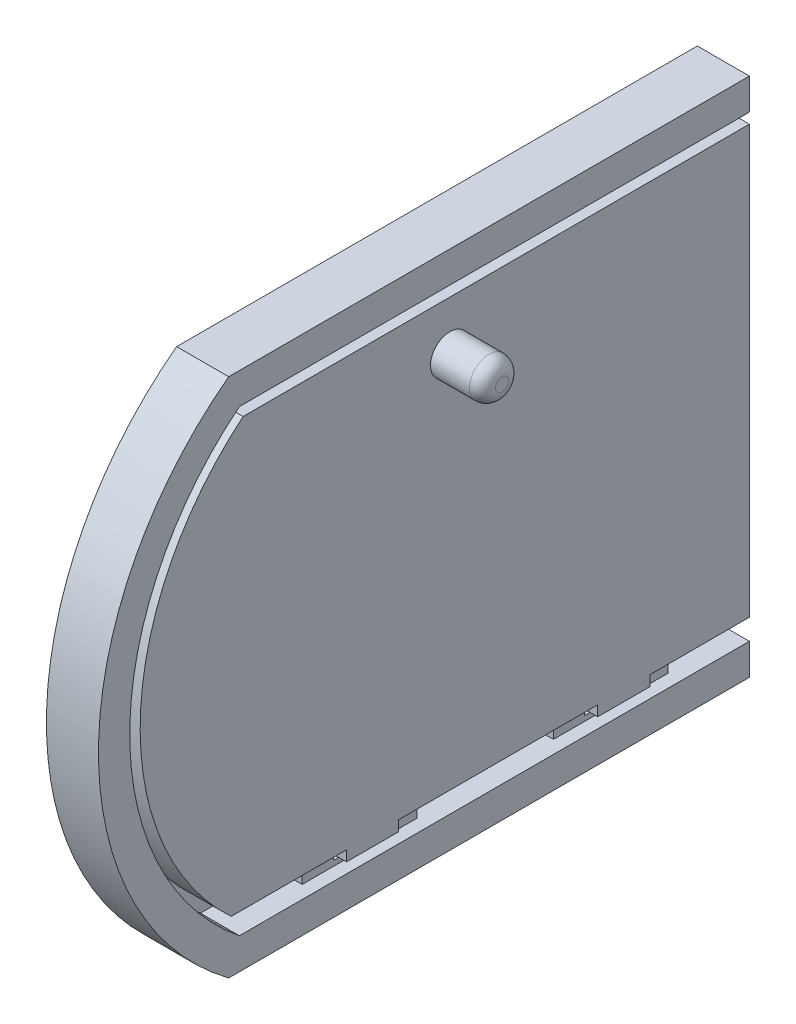
from build123d import *

# Parameters (mm, degrees)
SALIENTE_EXTRUIR1_DEPTH      = 20
CORTAR_EXTRUIR1_START        = -5
CORTAR_EXTRUIR1_DEPTH        = 5
CROQUIS3_W                   = 6
CROQUIS3_H                   = 20
CORTAR_EXTRUIR2_DEPTH        = 10
CROQUIS4_R                   = 2.75
CORTAR_EXTRUIR3_DEPTH        = 10
SIMETR_A2_COPY_1_SKETCH_R    = 2.75
SIMETR_A2_COPY_1_DEPTH       = 10
SALIENTE_EXTRUIR2_DEPTH      = 5
SALIENTE_EXTRUIR2_DEPTH_BACK = 10
CROQUIS6_R                   = 2.25
SALIENTE_EXTRUIR3_DEPTH      = 9
SIMETR_A4_COPY_1_SKETCH_R    = 2.25
SIMETR_A4_COPY_1_DEPTH       = 9
CORTAR_EXTRUIR4_START        = -10
CROQUIS7_W                   = 8
CROQUIS7_H                   = 26.251838136
CROQUIS7_H_2                 = 52.503676272
CORTAR_EXTRUIR4_DEPTH        = 10
CROQUIS8_R                   = 7.5
SALIENTE_EXTRUIR5_DEPTH      = 20
REDONDEO1_R                  = 5


with BuildPart() as part:
    # Croquis1 → Saliente-Extruir1 (new body)
    with BuildSketch(Plane.YZ):
        with BuildLine():
            Line((-100, -125), (-100, 75))
            ThreePointArc((-100, 75), (0, 125), (100, 75))
            Line((100, 75), (100, -125))
            Line((100, -125), (80, -125))
            Line((80, -125), (80, -105))
            Line((80, -105), (80, 68.007352544))
            ThreePointArc((80, 68.007352544), (0, 105), (-80, 68.007352544))
            Line((-80, 68.007352544), (-80, -105))
            Line((-80, -105), (-80, -125))
            Line((-80, -125), (-100, -125))
        make_face()
    extrude(amount=SALIENTE_EXTRUIR1_DEPTH)

    # Croquis2 → Cortar-Extruir1 (cut)
    with BuildSketch(Plane.YZ.offset(20).offset(CORTAR_EXTRUIR1_START)):
        with BuildLine():
            Line((88, 70.887234394), (88, -125))
            Line((88, -125), (80, -125))
            Line((80, -125), (80, 68.007352544))
            ThreePointArc((80, 68.007352544), (0, 105), (-80, 68.007352544))
            Line((-80, 68.007352544), (-80, -125))
            Line((-80, -125), (-88, -125))
            Line((-88, -125), (-88, 70.887234394))
            ThreePointArc((-88, 70.887234394), (0, 113), (88, 70.887234394))
        make_face()
    extrude(amount=CORTAR_EXTRUIR1_DEPTH, mode=Mode.SUBTRACT)

    # Croquis3 → Cortar-Extruir2 (cut)
    with BuildSketch(Plane.YZ.offset(15)):
        with Locations((-83, -76.748161864)):
            Rectangle(CROQUIS3_W, CROQUIS3_H)
        with Locations((-83, 19.755514408)):
            Rectangle(CROQUIS3_W, CROQUIS3_H)
    extrude(amount=-CORTAR_EXTRUIR2_DEPTH, mode=Mode.SUBTRACT)

    # Croquis4 → Cortar-Extruir3 (cut)
    with BuildSketch(Plane(origin=(0, 0, 29.755514408), x_dir=(1, 0, 0), z_dir=(0, 0, -1))):
        with Locations(Location((10, 83, 0), (0, 0, 180))):
            Circle(CROQUIS4_R)
    cortar_extruir3 = extrude(amount=-CORTAR_EXTRUIR3_DEPTH, mode=Mode.SUBTRACT)

    # Simetría1: Cortar-Extruir3 across plane
    add(cortar_extruir3.mirror(Plane(origin=(0, 0, 19.755514408), x_dir=(1, 0, 0), z_dir=(0, 0, -1))), mode=Mode.SUBTRACT)

    # Simetría2: Cortar-Extruir3 across plane
    add(cortar_extruir3.mirror(Plane(origin=(0, 0, -28.496323728), x_dir=(1, 0, 0), z_dir=(0, 0, -1))), mode=Mode.SUBTRACT)

    # Simetría2 copy 1 sketch → Simetría2 copy 1 (cut)
    with BuildSketch(Plane(origin=(0, 0, -66.748161864), x_dir=(1, 0, 0), z_dir=(0, 0, -1))):
        with Locations(Location((10, 83, 0), (0, 0, 180))):
            Circle(SIMETR_A2_COPY_1_SKETCH_R)
    extrude(amount=-SIMETR_A2_COPY_1_DEPTH, mode=Mode.SUBTRACT)

    # Croquis7 → Cortar-Extruir4 (cut)
    with BuildSketch(Plane.YZ.offset(15).offset(CORTAR_EXTRUIR4_START)):
        with Locations((-84, -111.874080932)):
            Rectangle(CROQUIS7_W, CROQUIS7_H)
        with Locations((-84, -28.496323728)):
            Rectangle(CROQUIS7_W, CROQUIS7_H_2)
        with BuildLine():
            Line((-88, 41.755514408), (-80, 41.755514408))
            Line((-80, 41.755514408), (-80, 68.007352544))
            ThreePointArc((-80, 68.007352544), (0, 105), (80, 68.007352544))
            Line((80, 68.007352544), (80, -125))
            Line((80, -125), (88, -125))
            Line((88, -125), (88, 70.887234394))
            ThreePointArc((88, 70.887234394), (0, 113), (-88, 70.887234394))
            Line((-88, 70.887234394), (-88, 41.755514408))
        make_face()
    extrude(amount=CORTAR_EXTRUIR4_DEPTH, mode=Mode.SUBTRACT)


with BuildPart() as body_2:
    # Croquis5 → Saliente-Extruir2 (new, two sides: drawn at the far end of the back side and taken through both)
    with BuildSketch(Plane.YZ.offset(15).offset(-SALIENTE_EXTRUIR2_DEPTH_BACK)):
        with BuildLine():
            Line((-80, -125), (84, -125))
            Line((84, -125), (84, 69.462219947))
            ThreePointArc((84, 69.462219947), (3.037232516, 108.957676272), (-80, 74.033776076))
            Line((-80, 74.033776076), (-80, 29.755514408))
            Line((-80, 29.755514408), (-84, 29.755514408))
            Line((-84, 29.755514408), (-84, 9.755514408))
            Line((-84, 9.755514408), (-80, 9.755514408))
            Line((-80, 9.755514408), (-80, -66.748161864))
            Line((-80, -66.748161864), (-84, -66.748161864))
            Line((-84, -66.748161864), (-84, -86.748161864))
            Line((-84, -86.748161864), (-80, -86.748161864))
            Line((-80, -86.748161864), (-80, -125))
        make_face()
    extrude(amount=SALIENTE_EXTRUIR2_DEPTH + SALIENTE_EXTRUIR2_DEPTH_BACK)

    # Croquis6 → Saliente-Extruir3 (add)
    with BuildSketch(Plane.XY.offset(29.755514408)):
        with Locations(Location((10, -83, 0), (0, 0, 206.387799961))):
            Circle(CROQUIS6_R)
    saliente_extruir3 = extrude(amount=SALIENTE_EXTRUIR3_DEPTH)

    # Simetría3: Saliente-Extruir3 across plane
    add(saliente_extruir3.mirror(Plane(origin=(0, 0, 19.755514408), x_dir=(1, 0, 0), z_dir=(0, 0, -1))))

    # Simetría4: Saliente-Extruir3 across plane
    add(saliente_extruir3.mirror(Plane(origin=(0, 0, -28.496323728), x_dir=(1, 0, 0), z_dir=(0, 0, -1))))

    # Simetría4 copy 1 sketch → Simetría4 copy 1 (add)
    with BuildSketch(Plane.XY.offset(-66.748161864)):
        with Locations(Location((10, -83, 0), (0, 0, 206.387799961))):
            Circle(SIMETR_A4_COPY_1_SKETCH_R)
    extrude(amount=SIMETR_A4_COPY_1_DEPTH)

    # Croquis8 → Saliente-Extruir5 (add)
    with BuildSketch(Plane.YZ.offset(20)):
        with Locations(Location((65, -10, 0), (0, 0, 270))):
            Circle(CROQUIS8_R)
    extrude(amount=SALIENTE_EXTRUIR5_DEPTH)

    # Redondeo1
    redondeo1_edges = [body_2.edges().sort_by_distance(p)[0] for p in [
        (40, 65, -2.5),
    ]]
    fillet(redondeo1_edges, radius=REDONDEO1_R)


solid = Compound([part.part, body_2.part])
